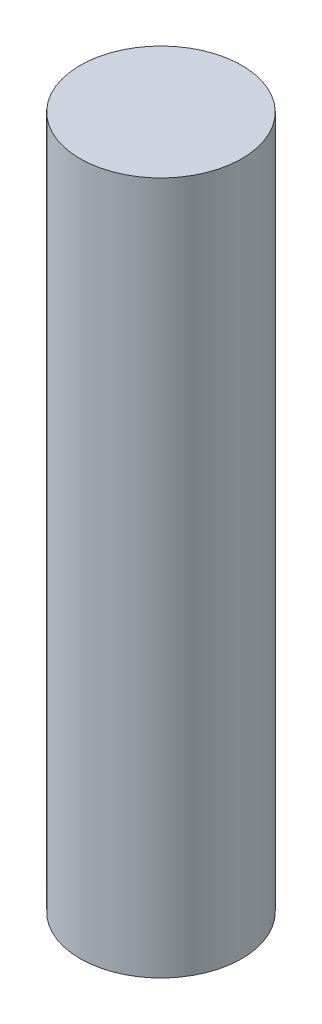
from build123d import *

# Parameters (mm, degrees)
CUT_EXTRUDE_1_DEPTH      = 10
CUT_EXTRUDE_1_DEPTH_BACK = 10
SKETCH_2_R               = 10


with BuildPart() as part:
    # Эскиз1 → Повернуть1 (revolve)
    with BuildSketch(Plane.XY):
        Polygon((-30, 50), (0, 50), (0, 0), (-35, 0), (-35, 300), (0, 300), (0, 280), (-30, 280), align=None)
    revolve(axis=Axis((0, 50, 0), (0, -1, 0)))

    # Эскиз2 → Вырез-Вытянуть1 (cut, two sides: drawn at the far end of the back side and taken through both)
    with BuildSketch(Plane.XY.offset(-32).offset(-CUT_EXTRUDE_1_DEPTH_BACK)):
        with Locations((0, 25)):
            Circle(SKETCH_2_R)
    extrude(amount=CUT_EXTRUDE_1_DEPTH + CUT_EXTRUDE_1_DEPTH_BACK, mode=Mode.SUBTRACT)


solid = part.part
